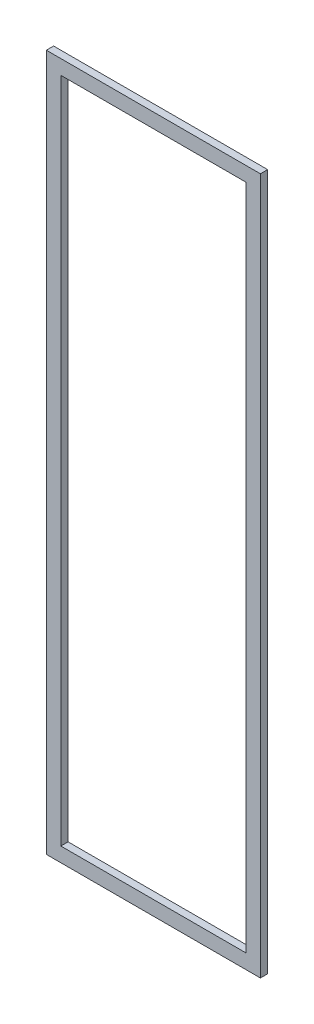
from build123d import *

# Parameters (mm, degrees)
CROQUIS1_W              = 750
CROQUIS1_H              = 2440
CROQUIS1_W_2            = 648.4
CROQUIS1_H_2            = 2338.4
SALIENTE_EXTRUIR1_DEPTH = 25.4


with BuildPart() as part:
    # Croquis1 → Saliente-Extruir1 (new body)
    with BuildSketch(Plane.XY):
        with Locations((375, -1220)):
            Rectangle(CROQUIS1_W, CROQUIS1_H)
        with Locations((375, -1220)):
            Rectangle(CROQUIS1_W_2, CROQUIS1_H_2, mode=Mode.SUBTRACT)
    extrude(amount=SALIENTE_EXTRUIR1_DEPTH)


solid = part.part
